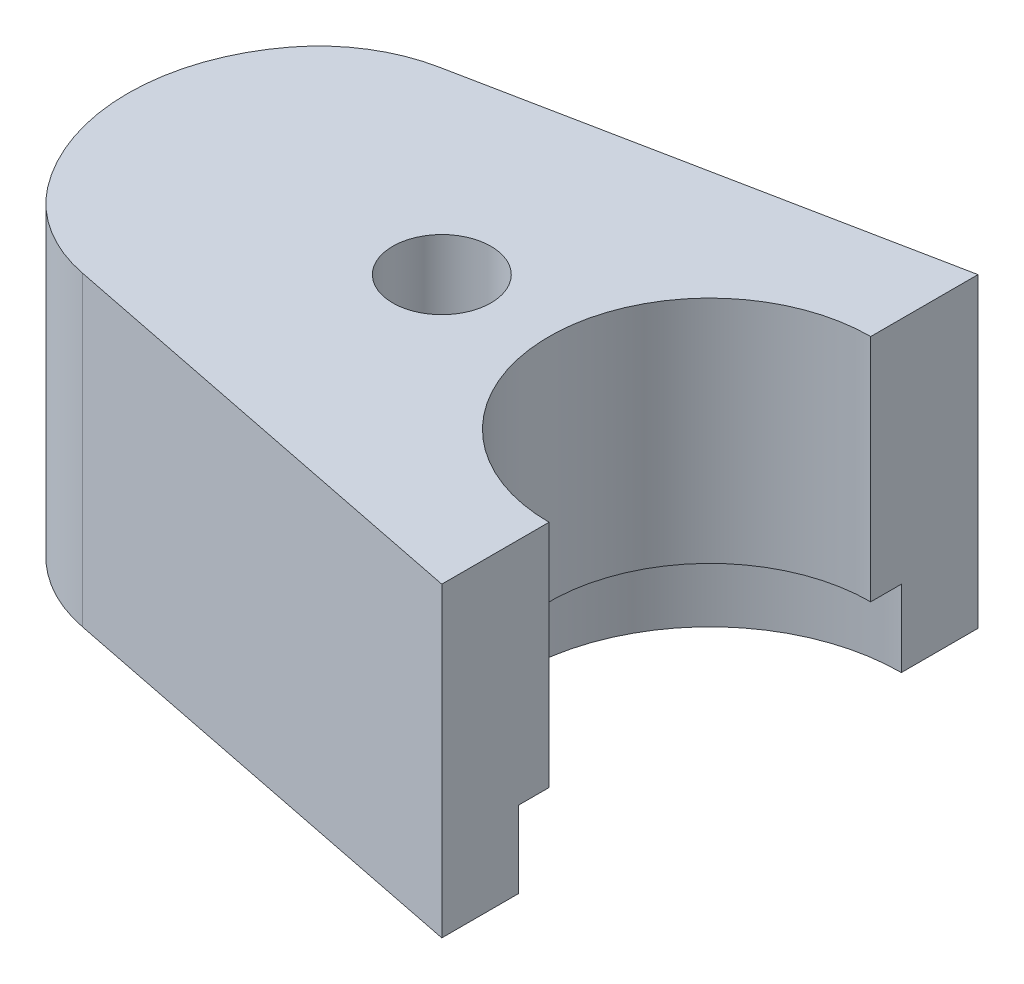
from build123d import *

# Parameters (mm, degrees)
SKETCH1_R           = 0.3207
BOSS_EXTRUDE1_DEPTH = 0.5
BOSS_EXTRUDE3_START = 0.5
SKETCH1_20_R        = 0.3207
BOSS_EXTRUDE3_DEPTH = 1.5


with BuildPart() as part:
    # Sketch1 → Boss-Extrude1 (new body)
    with BuildSketch(Plane(origin=(0, 0, 0), x_dir=(1, 0, 0), z_dir=(0, 1, 0))):
        with BuildLine():
            Line((-1.25, 1.25), (-1.25, 1.750241174))
            Line((-1.25, 1.750241174), (-4.183235691, 1.164159973))
            ThreePointArc((-4.183235691, 1.164159973), (-4.514100231, 1.033532975), (-4.77830642, 0.795352694))
            ThreePointArc((-4.77830642, 0.795352694), (-5.05, 0), (-4.77830642, -0.795352694))
            ThreePointArc((-4.77830642, -0.795352694), (-4.514100231, -1.033532975), (-4.183235691, -1.164159973))
            Line((-4.183235691, -1.164159973), (-1.25, -1.750241174))
            Line((-1.25, -1.750241174), (-1.25, -1.25))
            ThreePointArc((-1.25, -1.25), (-2.5, 0), (-1.25, 1.25))
        make_face()
        with Locations((-3, 0)):
            Circle(SKETCH1_R, mode=Mode.SUBTRACT)
    extrude(amount=BOSS_EXTRUDE1_DEPTH)

    # Sketch1<20> → Boss-Extrude3 (add)
    with BuildSketch(Plane(origin=(0, 0, 0), x_dir=(1, 0, 0), z_dir=(0, 1, 0)).offset(BOSS_EXTRUDE3_START)):
        with BuildLine():
            Line((-1.25, 1.750241174), (-4.183235691, 1.164159973))
            ThreePointArc((-4.183235691, 1.164159973), (-4.514100231, 1.033532975), (-4.77830642, 0.795352694))
            ThreePointArc((-4.77830642, 0.795352694), (-5.05, 0), (-4.77830642, -0.795352694))
            ThreePointArc((-4.77830642, -0.795352694), (-4.514100231, -1.033532975), (-4.183235691, -1.164159973))
            Line((-4.183235691, -1.164159973), (-1.25, -1.750241174))
            Line((-1.25, -1.750241174), (-1.25, -1.05))
            ThreePointArc((-1.25, -1.05), (-2.3, 0), (-1.25, 1.05))
            Line((-1.25, 1.05), (-1.25, 1.750241174))
        make_face()
        with Locations((-3, 0)):
            Circle(SKETCH1_20_R, mode=Mode.SUBTRACT)
    extrude(amount=BOSS_EXTRUDE3_DEPTH)


solid = part.part
